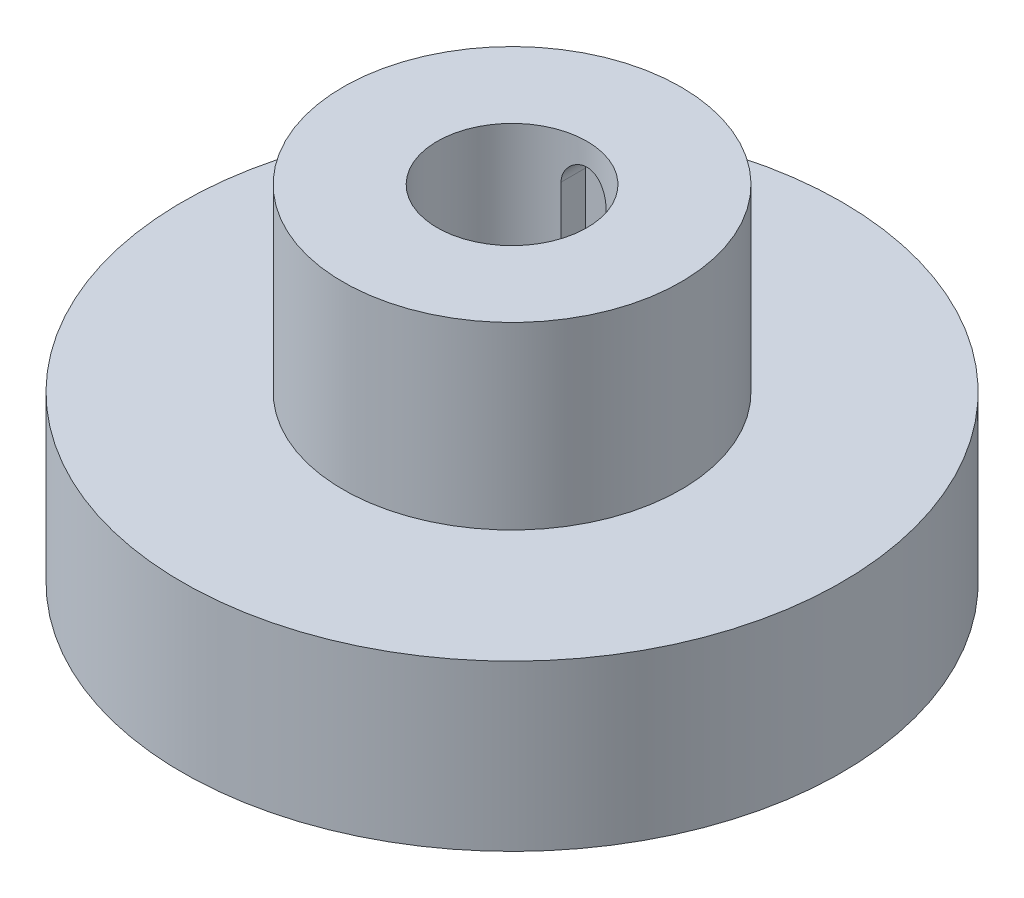
from build123d import *

# Parameters (mm, degrees)
CUT_EXTRUDE_1_DEPTH = 6.4


with BuildPart() as part:
    # Эскиз1 → Повернуть1 (revolve)
    with BuildSketch(Plane.XY, mode=Mode.PRIVATE) as revolve_1_sk:
        Polygon((5, 23), (5, 0), (22, 0), (22, 11), (11.27928518, 11), (11.27928518, 23), align=None)
    revolve(revolve_1_sk.sketch.rotate(Axis((0, 0, 0), (0, 1, 0)), 90), axis=Axis((0, 0, 0), (0, 1, 0)))

    # Эскиз2 → Вырез-Вытянуть1 (cut)
    with BuildSketch(Plane.XY):
        with BuildLine():
            Line((-1.5, 5), (-1.5, 20))
            ThreePointArc((-1.5, 20), (0, 21.5), (1.5, 20))
            Line((1.5, 20), (1.5, 5))
            ThreePointArc((1.5, 5), (0, 3.5), (-1.5, 5))
        make_face()
    extrude(amount=-CUT_EXTRUDE_1_DEPTH, mode=Mode.SUBTRACT)


solid = part.part
